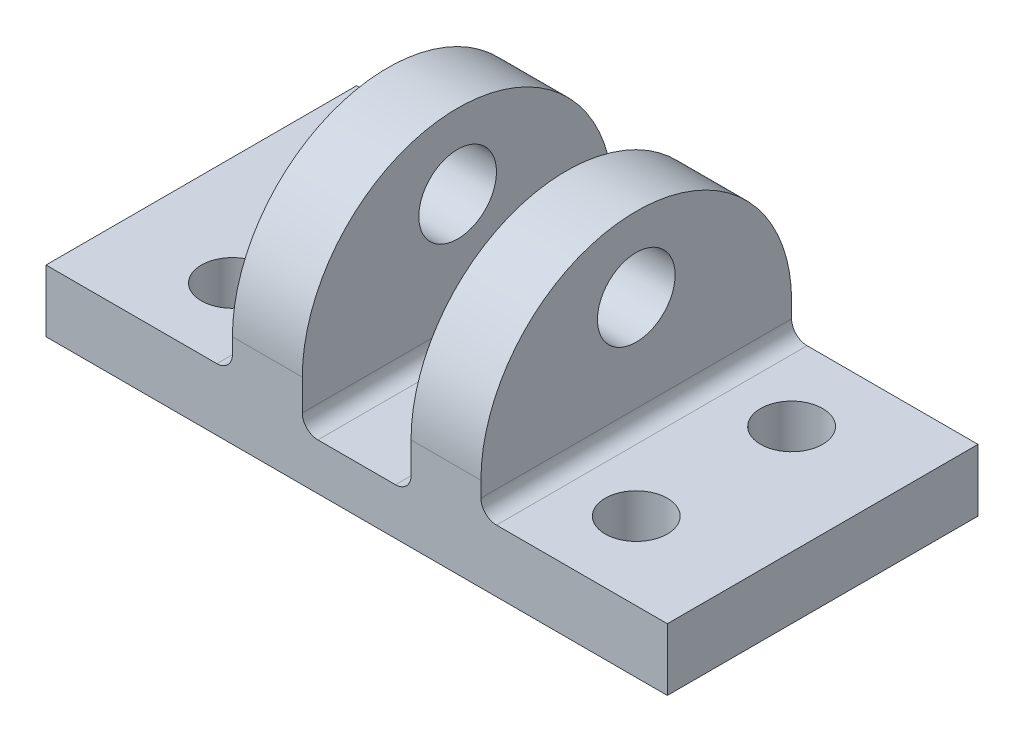
from build123d import *

# Parameters (mm, degrees)
BOSS_EXTRUDE1_DEPTH = 4.7625
SKETCH2_W           = 25.4
SKETCH2_H           = 31.75
BOSS_EXTRUDE2_DEPTH = 20.6375
SKETCH4_R           = 3.96875
CUT_EXTRUDE2_DEPTH  = 61.241389426
FILLET2_RADIUS      = 15.875
FILLET2_LENGTH      = 25.4
SKETCH5_W           = 11.1125
SKETCH5_H           = 24.885554027
CUT_EXTRUDE3_DEPTH  = 52.587643869
SKETCH6_R           = 3.175
CUT_EXTRUDE4_DEPTH  = 50.416914172
BOSS_EXTRUDE3_START = 1.5875
SKETCH10_W          = 19.05
SKETCH10_H          = 31.75
SKETCH10_R          = 3.175
BOSS_EXTRUDE3_DEPTH = 1.5875
FILLET3_R           = 1.5875


with BuildPart() as part:
    # Sketch1 → Boss-Extrude1 (new body)
    with BuildSketch(Plane(origin=(0, 0, 0), x_dir=(1, 0, 0), z_dir=(0, 1, 0))):
        Polygon((-31.75, 0), (31.75, 0), (31.75, -31.75), (15.875, -31.75), (-15.875, -31.75), (-31.75, -31.75), align=None)
    extrude(amount=BOSS_EXTRUDE1_DEPTH)

    # Sketch2 → Boss-Extrude2 (add)
    with BuildSketch(Plane(origin=(0, 4.7625, 0), x_dir=(1, 0, 0), z_dir=(0, 1, 0))):
        with Locations((0, -15.875)):
            Rectangle(SKETCH2_W, SKETCH2_H)
    extrude(amount=BOSS_EXTRUDE2_DEPTH)

    # Sketch4 → Cut-Extrude2 (cut, through all)
    with BuildSketch(Plane(origin=(12.7, 0, 0), x_dir=(0, 0, -1), z_dir=(1, 0, 0))):
        with Locations((-15.875, 17.78)):
            Circle(SKETCH4_R)
    extrude(amount=-CUT_EXTRUDE2_DEPTH, mode=Mode.SUBTRACT)

    # Fillet2: full round fillet: the end face becomes a half cylinder, R = half its width
    fillet2_face = Plane((0, 25.4, 15.875), x_dir=(1, 0, 0), z_dir=(0, 1, 0))  # on the end face: x along it, z out of the body
    fillet2_slab = fillet2_face.offset(-FILLET2_RADIUS / 2) * Box(FILLET2_LENGTH, 2 * FILLET2_RADIUS, FILLET2_RADIUS, mode=Mode.PRIVATE)  # the body's end, R deep
    fillet2_round = Plane((0, 9.525, 15.875), x_dir=(0, 1, 0), z_dir=(1, 0, 0)) * Cylinder(FILLET2_RADIUS, FILLET2_LENGTH, mode=Mode.PRIVATE)  # its axis R under the face
    add(fillet2_slab - fillet2_round, mode=Mode.SUBTRACT)

    # Sketch5 → Cut-Extrude3 (cut, through all)
    with BuildSketch(Plane.XY.offset(31.75)):
        with Locations((0, 17.205277014)):
            Rectangle(SKETCH5_W, SKETCH5_H)
    extrude(amount=-CUT_EXTRUDE3_DEPTH, mode=Mode.SUBTRACT)

    # Sketch6 → Cut-Extrude4 (cut, through all)
    with BuildSketch(Plane(origin=(0, 4.7625, 0), x_dir=(1, 0, 0), z_dir=(0, 1, 0))):
        with Locations(Location((-20.6375, -7.9375, 0), (0, 0, 270))):
            Circle(SKETCH6_R)
        with Locations(Location((20.6375, -7.9375, 0), (0, 0, 270))):
            Circle(SKETCH6_R)
        with Locations(Location((20.6375, -23.8125, 0), (0, 0, 270))):
            Circle(SKETCH6_R)
        with Locations(Location((-20.6375, -23.8125, 0), (0, 0, 270))):
            Circle(SKETCH6_R)
    extrude(amount=-CUT_EXTRUDE4_DEPTH, mode=Mode.SUBTRACT)

    # Sketch10 → Boss-Extrude3 (add)
    # profile 1 of 2: a face of its own
    with BuildSketch(Plane(origin=(0, 4.7625, 0), x_dir=(1, 0, 0), z_dir=(0, 1, 0)).offset(BOSS_EXTRUDE3_START)):
        with Locations((-22.225, -15.875)):
            Rectangle(SKETCH10_W, SKETCH10_H)
        with Locations(Location((-20.6375, -23.8125, 0), (0, 0, 270))):
            Circle(SKETCH10_R, mode=Mode.SUBTRACT)
        with Locations(Location((-20.6375, -7.9375, 0), (0, 0, 270))):
            Circle(SKETCH10_R, mode=Mode.SUBTRACT)
    # profile 2 of 2: a face of its own
    with BuildSketch(Plane(origin=(0, 4.7625, 0), x_dir=(1, 0, 0), z_dir=(0, 1, 0)).offset(BOSS_EXTRUDE3_START)):
        with Locations((22.225, -15.875)):
            Rectangle(SKETCH10_W, SKETCH10_H)
        with Locations(Location((20.6375, -7.9375, 0), (0, 0, 270))):
            Circle(SKETCH10_R, mode=Mode.SUBTRACT)
        with Locations(Location((20.6375, -23.8125, 0), (0, 0, 270))):
            Circle(SKETCH10_R, mode=Mode.SUBTRACT)
    extrude(amount=-BOSS_EXTRUDE3_DEPTH)

    # Fillet3
    fillet3_edges = [part.edges().sort_by_distance(p)[0] for p in [
        (12.7, 6.35, 15.875),
        (5.55625, 4.7625, 15.875),
        (-5.55625, 4.7625, 15.875),
        (-12.7, 6.35, 15.875),
    ]]
    fillet(fillet3_edges, radius=FILLET3_R)


solid = part.part
